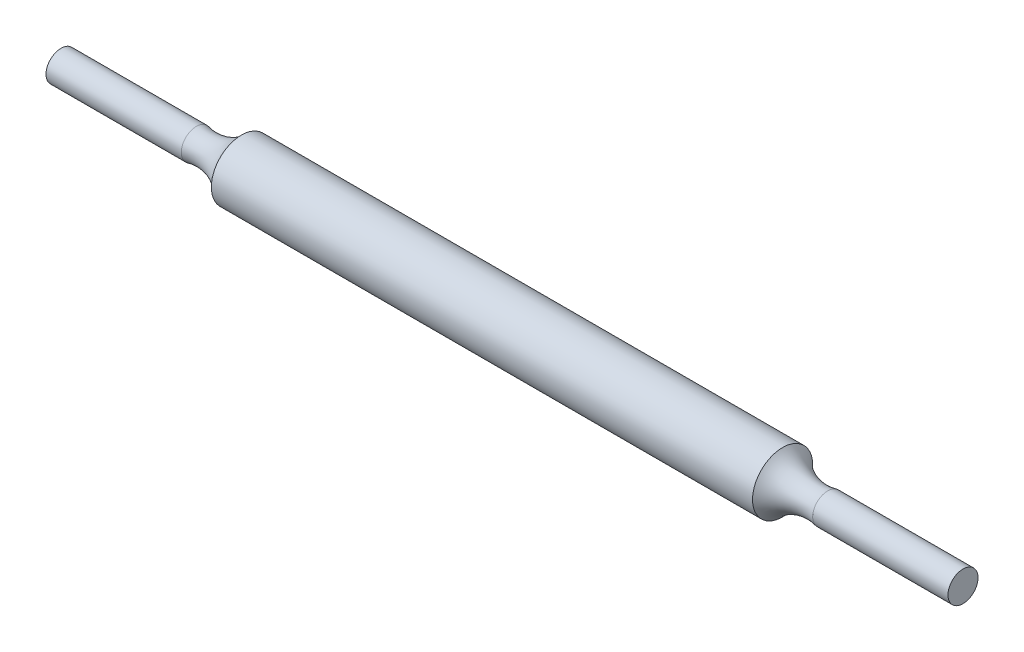
from build123d import *


with BuildPart() as part:
    # Sketch2 → Revolve4 (revolve)
    with BuildSketch(Plane.XY, mode=Mode.PRIVATE) as revolve4_sk:
        with BuildLine():
            Line((-762, 0), (762, 0))
            Line((762, 0), (762, 25.4))
            Line((762, 25.4), (533.4, 25.4))
            ThreePointArc((533.4, 25.4), (491.68157891, 27.244736731), (457.2, 50.8))
            Line((457.2, 50.8), (-457.2, 50.8))
            ThreePointArc((-457.2, 50.8), (-491.68157891, 27.244736731), (-533.4, 25.4))
            Line((-533.4, 25.4), (-762, 25.4))
            Line((-762, 25.4), (-762, 0))
        make_face()
    revolve(revolve4_sk.sketch.rotate(Axis((-762, 0, 0), (1, 0, 0)), 90), axis=Axis((-762, 0, 0), (1, 0, 0)))


solid = part.part
